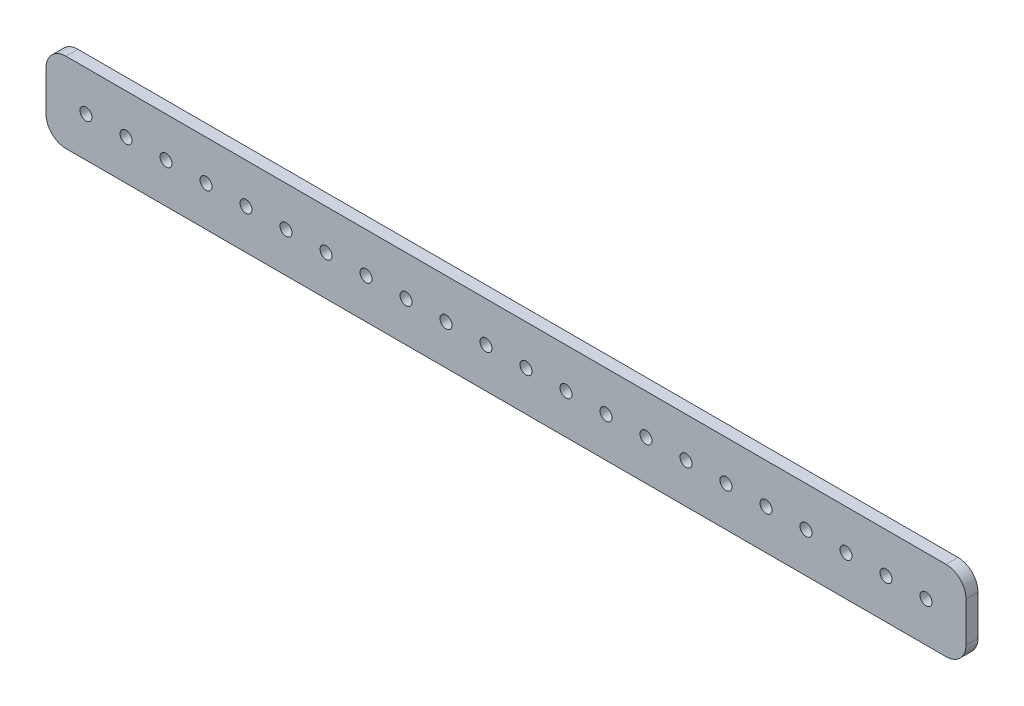
from build123d import *

# Parameters (mm, degrees)
SKETCH1_R           = 1.5
BOSS_EXTRUDE1_DEPTH = 3


with BuildPart() as part:
    # Sketch1 → Boss-Extrude1 (new body)
    with BuildSketch(Plane.XY):
        with BuildLine():
            Line((-110, 10), (110, 10))
            ThreePointArc((110, 10), (113.535533906, 8.535533906), (115, 5))
            Line((115, 5), (115, -5))
            ThreePointArc((115, -5), (113.535533906, -8.535533906), (110, -10))
            Line((110, -10), (-110, -10))
            ThreePointArc((-110, -10), (-113.535533906, -8.535533906), (-115, -5))
            Line((-115, -5), (-115, 5))
            ThreePointArc((-115, 5), (-113.535533906, 8.535533906), (-110, 10))
        make_face()
        with Locations((-105, 0)):
            Circle(SKETCH1_R, mode=Mode.SUBTRACT)
        with Locations((-95, 0)):
            Circle(SKETCH1_R, mode=Mode.SUBTRACT)
        with Locations((-85, 0)):
            Circle(SKETCH1_R, mode=Mode.SUBTRACT)
        with Locations((-75, 0)):
            Circle(SKETCH1_R, mode=Mode.SUBTRACT)
        with Locations((-65, 0)):
            Circle(SKETCH1_R, mode=Mode.SUBTRACT)
        with Locations((-55, 0)):
            Circle(SKETCH1_R, mode=Mode.SUBTRACT)
        with Locations((-45, 0)):
            Circle(SKETCH1_R, mode=Mode.SUBTRACT)
        with Locations((-35, 0)):
            Circle(SKETCH1_R, mode=Mode.SUBTRACT)
        with Locations((-25, 0)):
            Circle(SKETCH1_R, mode=Mode.SUBTRACT)
        with Locations((-15, 0)):
            Circle(SKETCH1_R, mode=Mode.SUBTRACT)
        with Locations((-5, 0)):
            Circle(SKETCH1_R, mode=Mode.SUBTRACT)
        with Locations((15, 0)):
            Circle(SKETCH1_R, mode=Mode.SUBTRACT)
        with Locations((25, 0)):
            Circle(SKETCH1_R, mode=Mode.SUBTRACT)
        with Locations((5, 0)):
            Circle(SKETCH1_R, mode=Mode.SUBTRACT)
        with Locations((35, 0)):
            Circle(SKETCH1_R, mode=Mode.SUBTRACT)
        with Locations((45, 0)):
            Circle(SKETCH1_R, mode=Mode.SUBTRACT)
        with Locations((55, 0)):
            Circle(SKETCH1_R, mode=Mode.SUBTRACT)
        with Locations((65, 0)):
            Circle(SKETCH1_R, mode=Mode.SUBTRACT)
        with Locations((75, 0)):
            Circle(SKETCH1_R, mode=Mode.SUBTRACT)
        with Locations((85, 0)):
            Circle(SKETCH1_R, mode=Mode.SUBTRACT)
        with Locations((95, 0)):
            Circle(SKETCH1_R, mode=Mode.SUBTRACT)
        with Locations((105, 0)):
            Circle(SKETCH1_R, mode=Mode.SUBTRACT)
    extrude(amount=BOSS_EXTRUDE1_DEPTH)


solid = part.part
